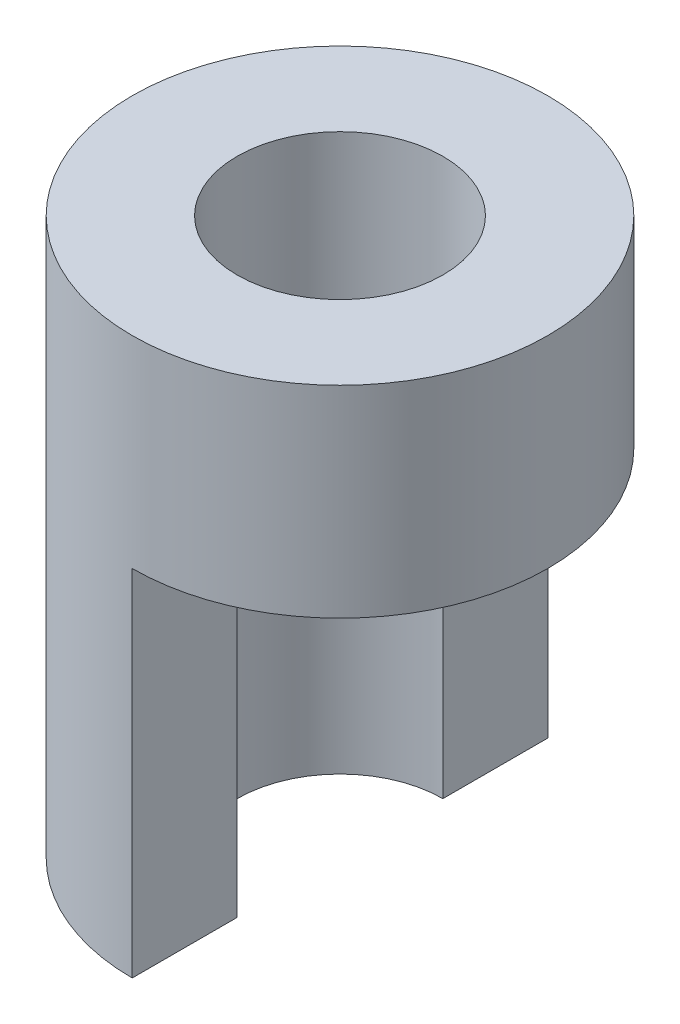
from build123d import *

# Parameters (mm, degrees)
EXTRUDE_1_DEPTH = 27.58
EXTRUDE_START   = -10
EXTRUDE_2_DEPTH = 10


with BuildPart() as part:
    # 草圖1 → 伸長-薄件1 (new body)
    with BuildSketch(Plane(origin=(0, 0, 0), x_dir=(1, 0, 0), z_dir=(0, 1, 0))):
        with BuildLine():
            ThreePointArc((0, 5.1), (-5.1, 0), (0, -5.1))
            Line((0, -5.1), (0, -10.3))
            ThreePointArc((0, -10.3), (-10.3, 0), (0, 10.3))
            Line((0, 10.3), (0, 5.1))
        make_face()
    extrude(amount=EXTRUDE_1_DEPTH)

    # 草圖3 → 伸長-薄件2 (add)
    with BuildSketch(Plane(origin=(0, 27.58, 0), x_dir=(1, 0, 0), z_dir=(0, 1, 0)).offset(EXTRUDE_START)):
        with BuildLine():
            ThreePointArc((0, -5.1), (5.1, 0), (0, 5.1))
            Line((0, 5.1), (0, 10.3))
            ThreePointArc((0, 10.3), (10.3, 0), (0, -10.3))
            Line((0, -10.3), (0, -5.1))
        make_face()
    extrude(amount=EXTRUDE_2_DEPTH)


solid = part.part
